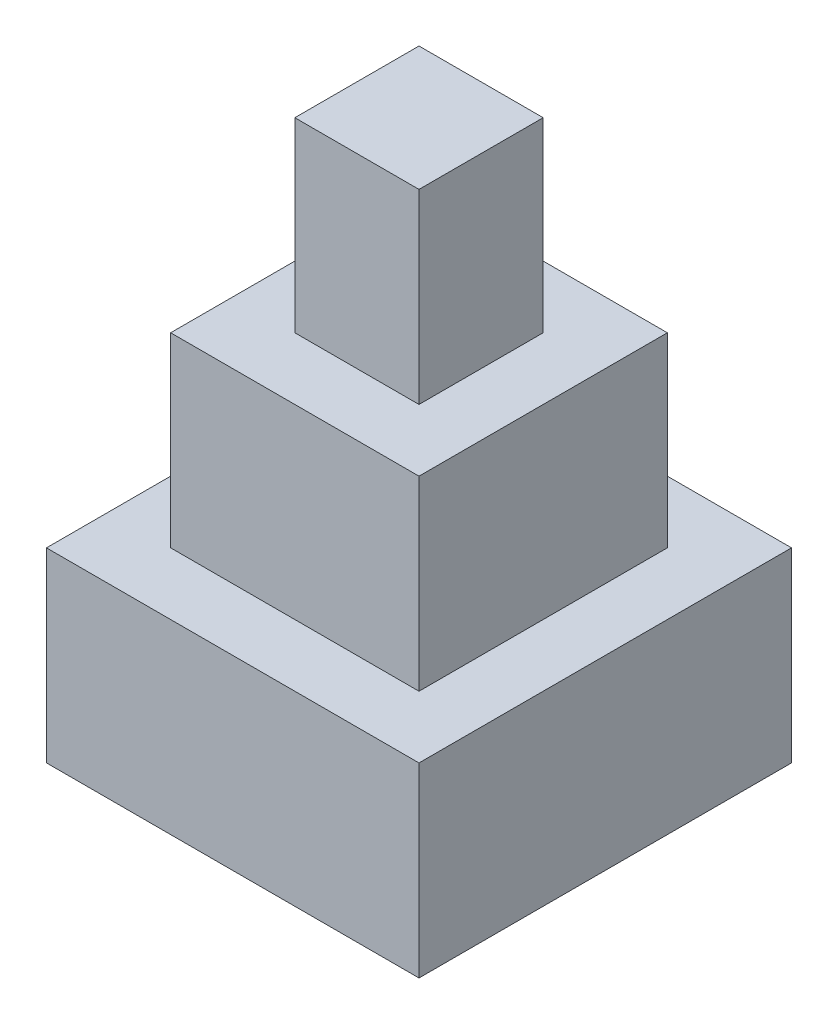
from build123d import *

# Parameters (mm, degrees)
SKETCH_1_W      = 60
SKETCH_1_H      = 60
EXTRUDE_1_DEPTH = 30
SKETCH_2_W      = 40
SKETCH_2_H      = 40
EXTRUDE_2_DEPTH = 30
SKETCH_3_W      = 20
SKETCH_3_H      = 20
EXTRUDE_3_DEPTH = 30


with BuildPart() as part:
    # 스케치1 → 보스-돌출1 (new body)
    with BuildSketch(Plane(origin=(0, 0, 0), x_dir=(1, 0, 0), z_dir=(0, 1, 0))):
        with Locations((-25.403215003, -7.463831212)):
            Rectangle(SKETCH_1_W, SKETCH_1_H)
    extrude(amount=EXTRUDE_1_DEPTH)

    # 스케치2 → 보스-돌출2 (add)
    with BuildSketch(Plane(origin=(0, 30, 0), x_dir=(1, 0, 0), z_dir=(0, 1, 0))):
        with Locations((-25.403215003, -7.463831212)):
            Rectangle(SKETCH_2_W, SKETCH_2_H)
    extrude(amount=EXTRUDE_2_DEPTH)

    # 스케치3 → 보스-돌출3 (add)
    with BuildSketch(Plane(origin=(0, 60, 0), x_dir=(1, 0, 0), z_dir=(0, 1, 0))):
        with Locations((-25.403215003, -7.463831212)):
            Rectangle(SKETCH_3_W, SKETCH_3_H)
    extrude(amount=EXTRUDE_3_DEPTH)


solid = part.part
